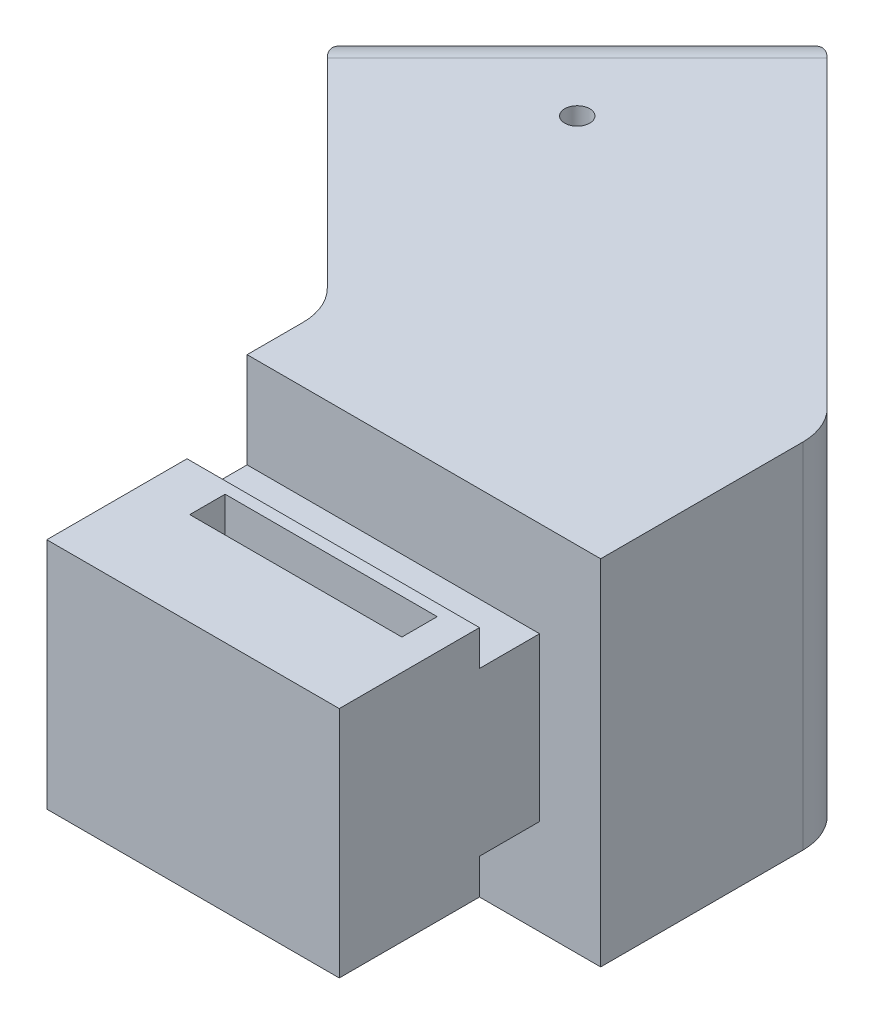
from build123d import *

# Parameters (mm, degrees)
BOSS_EXTRUDE1_DEPTH     = 38.1
SKETCH3_W               = 15.113
SKETCH3_H               = 6.477
CUT_EXTRUDE3_DEPTH      = 100.886424174
SKETCH4_W               = 22.86
SKETCH4_H               = 3.81
CUT_EXTRUDE4_DEPTH      = 108.200359108
SKETCH5_R               = 10.8585
CUT_EXTRUDE5_DEPTH      = 25.4
FILLET1_R               = 6.35
CUT_EXTRUDE6_DEPTH      = 110.286380048
CUT_EXTRUDE6_DEPTH_BACK = 110.286380048
SKETCH6_R               = 1.349999967
FILLET2_R               = 5.08


with BuildPart() as part:
    # Sketch1 → Boss-Extrude1 (new body)
    with BuildSketch(Plane(origin=(0, 0, 0), x_dir=(1, 0, 0), z_dir=(0, 1, 0))):
        Polygon((0, 0), (-31.5214, 0), (-31.5214, 30.226), (-58.462168363, 57.166768363), (-31.5214, 84.107536726), (6.5786, 46.007536726), (6.5786, 21.59), (0, 21.59), align=None)
    extrude(amount=BOSS_EXTRUDE1_DEPTH)

    # Sketch3 → Cut-Extrude3 (cut, through all)
    with BuildSketch(Plane.ZY.offset(31.5214)):
        Polygon((-15.113, 27.813), (-15.113, 31.623), (-15.113, 38.1), (-21.59, 38.1), (-21.59, 27.813), align=None)
        with Locations((-7.5565, 34.8615)):
            Rectangle(SKETCH3_W, SKETCH3_H)
        Polygon((-21.59, 10.287), (-21.59, 0), (-15.113, 0), (-15.113, 6.477), (-15.113, 10.287), align=None)
        with Locations((-7.5565, 3.2385)):
            Rectangle(SKETCH3_W, SKETCH3_H)
    extrude(amount=-CUT_EXTRUDE3_DEPTH, mode=Mode.SUBTRACT)

    # Sketch4 → Cut-Extrude4 (cut, through all)
    with BuildSketch(Plane.XZ.offset(-6.477)):
        with Locations((-14.732, -11.95324)):
            Rectangle(SKETCH4_W, SKETCH4_H)
    extrude(amount=-CUT_EXTRUDE4_DEPTH, mode=Mode.SUBTRACT)

    # Sketch5 → Cut-Extrude5 (cut)
    with BuildSketch(Plane(origin=(-57.814468363, 0, -57.814468363), x_dir=(-0.7071067811865489, 0, 0.7071067811865462), z_dir=(-0.7071067811865462, 0, -0.7071067811865489))):
        with Locations((-18.134013876, 19.05)):
            Circle(SKETCH5_R)
    extrude(amount=-CUT_EXTRUDE5_DEPTH, mode=Mode.SUBTRACT)

    # Fillet1
    fillet1_edges = [part.edges().sort_by_distance(p)[0] for p in [
        (-31.5214, 19.05, -30.226),
        (6.5786, 19.05, -46.007536726),
    ]]
    fillet(fillet1_edges, radius=FILLET1_R)

    # Sketch6 → Cut-Extrude6 (cut, two sides: drawn at the far end of the back side and taken through both)
    with BuildSketch(Plane(origin=(0, 38.1, 0), x_dir=(1, 0, 0), z_dir=(0, 1, 0)).offset(-CUT_EXTRUDE6_DEPTH_BACK)):
        with Locations(Location((-36.011528061, 61.656896424, 0), (0, 0, 270))):
            Circle(SKETCH6_R)
    extrude(amount=CUT_EXTRUDE6_DEPTH + CUT_EXTRUDE6_DEPTH_BACK, mode=Mode.SUBTRACT)

    # Fillet2
    fillet2_edges = [part.edges().sort_by_distance(p)[0] for p in [
        (-58.462168363, 19.05, -57.166768363),
        (-31.5214, 19.05, -84.107536726),
        (-44.991784182, 38.1, -70.637152545),
        (-44.991784182, 0, -70.637152545),
    ]]
    fillet(fillet2_edges, radius=FILLET2_R)


solid = part.part
